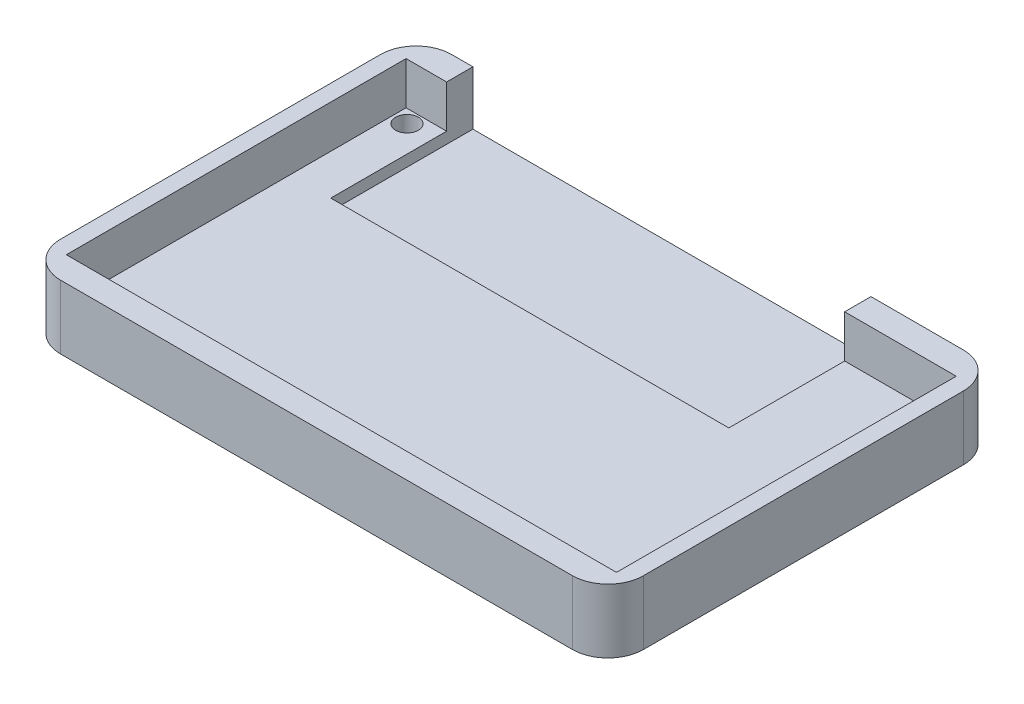
from build123d import *

# Parameters (mm, degrees)
SKETCH2_W           = 104.14
SKETCH2_H           = 69.85
BOSS_EXTRUDE1_DEPTH = 11.43
SKETCH3_W           = 71.12
SKETCH3_H           = 28.179594488
CUT_EXTRUDE1_DEPTH  = 9.652
CUT_EXTRUDE2_DEPTH  = 7.62
SKETCH5_R           = 2.032
CUT_EXTRUDE3_DEPTH  = 12.7
FILLET1_R           = 6.35


with BuildPart() as part:
    # Sketch2 → Boss-Extrude1 (new body)
    with BuildSketch(Plane(origin=(0, 0, 0), x_dir=(1, 0, 0), z_dir=(0, 1, 0))):
        Rectangle(SKETCH2_W, SKETCH2_H)
    extrude(amount=BOSS_EXTRUDE1_DEPTH)

    # Sketch3 → Cut-Extrude1 (cut)
    with BuildSketch(Plane(origin=(0, 11.43, 0), x_dir=(1, 0, 0), z_dir=(0, 1, 0))):
        with Locations((-6.35, 23.614797244)):
            Rectangle(SKETCH3_W, SKETCH3_H)
    extrude(amount=-CUT_EXTRUDE1_DEPTH, mode=Mode.SUBTRACT)

    # Sketch4 → Cut-Extrude2 (cut)
    with BuildSketch(Plane(origin=(0, 11.43, 0), x_dir=(1, 0, 0), z_dir=(0, 1, 0))):
        Polygon((49.149, 30.226), (-49.149, 30.226), (-49.149, -30.226), (-49.149, -30.48), (49.149, -30.48), (49.149, -30.226), align=None)
    extrude(amount=-CUT_EXTRUDE2_DEPTH, mode=Mode.SUBTRACT)

    # Sketch5 → Cut-Extrude3 (cut)
    with BuildSketch(Plane(origin=(0, 11.43, 0), x_dir=(1, 0, 0), z_dir=(0, 1, 0))):
        with Locations(Location((-46.609, 27.84475, 0), (0, 0, 270))):
            Circle(SKETCH5_R)
        with Locations(Location((46.609, 27.84475, 0), (0, 0, 270))):
            Circle(SKETCH5_R)
        with Locations(Location((46.609, -27.84475, 0), (0, 0, 270))):
            Circle(SKETCH5_R)
        with Locations(Location((-46.609, -27.84475, 0), (0, 0, 270))):
            Circle(SKETCH5_R)
    extrude(amount=-CUT_EXTRUDE3_DEPTH, mode=Mode.SUBTRACT)

    # Fillet1
    fillet1_edges = [part.edges().sort_by_distance(p)[0] for p in [
        (-52.07, 5.715, -34.925),
        (52.07, 5.715, -34.925),
        (52.07, 5.715, 34.925),
        (-52.07, 5.715, 34.925),
    ]]
    fillet(fillet1_edges, radius=FILLET1_R)


solid = part.part
